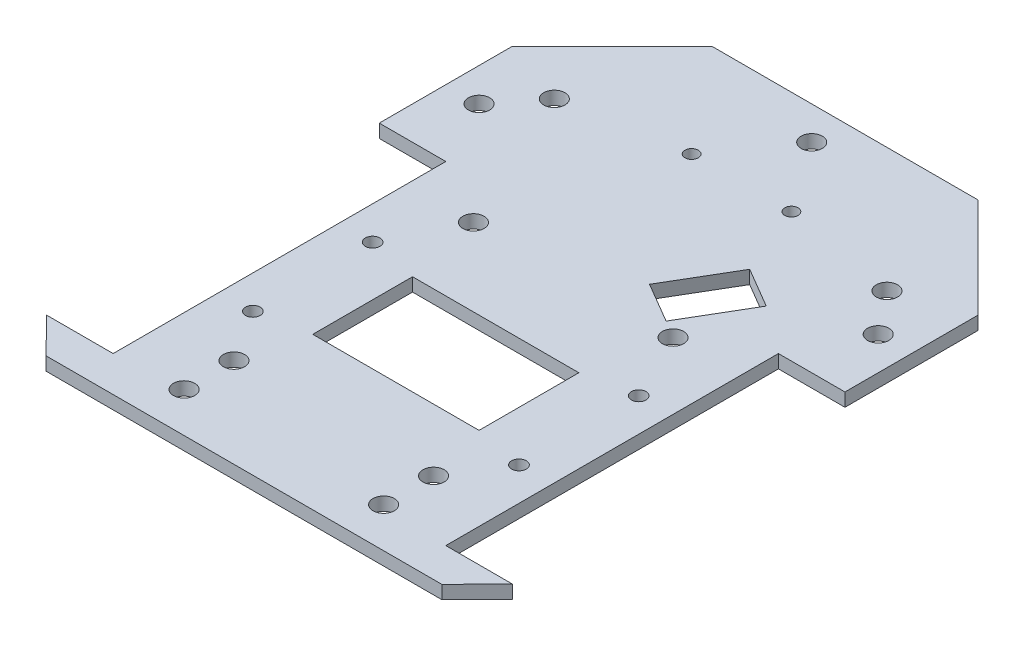
from build123d import *

# Parameters (mm, degrees)
SKETCH1_R           = 1.6
SKETCH1_R_2         = 1.1
SKETCH1_W           = 25
SKETCH1_H           = 15
BOSS_EXTRUDE1_DEPTH = 2
SKETCH2_R           = 1.6
CUT_EXTRUDE1_DEPTH  = 15
SKETCH3_R           = 1
CUT_EXTRUDE2_DEPTH  = 59.303758671


with BuildPart() as part:
    # Sketch1 → Boss-Extrude1 (new body)
    with BuildSketch(Plane(origin=(0, 0, 0), x_dir=(1, 0, 0), z_dir=(0, 1, 0))):
        Polygon((-20, 46.586782193), (20, 46.586782193), (35, 31.586782193), (35, 11.586782193), (25, 11.586782193), (25, -38.413217807), (35, -38.413217807), (29.754571716, -43.75543078), (-29.754571716, -43.75543078), (-35, -38.413217807), (-25, -38.413217807), (-25, 11.586782193), (-35, 11.586782193), (-35, 31.586782193), align=None)
        with Locations(Location((-30, 21.586782193, 0), (0, 0, 270))):
            Circle(SKETCH1_R, mode=Mode.SUBTRACT)
        with Locations(Location((30, 21.586782193, 0), (0, 0, 90))):
            Circle(SKETCH1_R, mode=Mode.SUBTRACT)
        with Locations(Location((0, 41.586782193, 0), (0, 0, 270))):
            Circle(SKETCH1_R, mode=Mode.SUBTRACT)
        with Locations(Location((-20, -4.413217807, 0), (0, 0, 270))):
            Circle(SKETCH1_R_2, mode=Mode.SUBTRACT)
        with Locations(Location((-20, -22.413217807, 0), (0, 0, 90))):
            Circle(SKETCH1_R_2, mode=Mode.SUBTRACT)
        with Locations(Location((20, -4.413217807, 0), (0, 0, 90))):
            Circle(SKETCH1_R_2, mode=Mode.SUBTRACT)
        with Locations(Location((20, -22.413217807, 0), (0, 0, 270))):
            Circle(SKETCH1_R_2, mode=Mode.SUBTRACT)
        with Locations(Location((-15, -37.75543078, 0), (0, 0, 270))):
            Circle(SKETCH1_R, mode=Mode.SUBTRACT)
        with Locations(Location((15, -37.75543078, 0), (0, 0, 90))):
            Circle(SKETCH1_R, mode=Mode.SUBTRACT)
        with Locations(Location((-15, 5.74456922, 0), (0, 0, 270))):
            Circle(SKETCH1_R, mode=Mode.SUBTRACT)
        with Locations(Location((15, 5.74456922, 0), (0, 0, 90))):
            Circle(SKETCH1_R, mode=Mode.SUBTRACT)
        with Locations(Location((-15, -30.25543078, 0), (0, 0, 270))):
            Circle(SKETCH1_R, mode=Mode.SUBTRACT)
        with Locations(Location((15, -30.25543078, 0), (0, 0, 90))):
            Circle(SKETCH1_R, mode=Mode.SUBTRACT)
        Polygon((12.330705785, 7.368716231), (17.905727496, 16.851286185), (11.871364798, 20.399027274), (6.296343087, 10.91645732), align=None, mode=Mode.SUBTRACT)
        with Locations((0, -13.413217807)):
            Rectangle(SKETCH1_W, SKETCH1_H, mode=Mode.SUBTRACT)
    extrude(amount=BOSS_EXTRUDE1_DEPTH)

    # Sketch2 → Cut-Extrude1 (cut)
    with BuildSketch(Plane(origin=(0, 2, 0), x_dir=(1, 0, 0), z_dir=(0, 1, 0))):
        with Locations(Location((-25, 27.900566449, 0), (0, 0, 270))):
            Circle(SKETCH2_R)
        with Locations(Location((25, 27.900566449, 0), (0, 0, 90))):
            Circle(SKETCH2_R)
    extrude(amount=-CUT_EXTRUDE1_DEPTH, mode=Mode.SUBTRACT)

    # Sketch3 → Cut-Extrude2 (cut, through all)
    with BuildSketch(Plane(origin=(0, 2, 0), x_dir=(1, 0, 0), z_dir=(0, 1, 0))):
        with Locations(Location((-7.5, 31.038288012, 0), (0, 0, 270))):
            Circle(SKETCH3_R)
        with Locations(Location((7.5, 31.038288012, 0), (0, 0, 90))):
            Circle(SKETCH3_R)
    extrude(amount=-CUT_EXTRUDE2_DEPTH, mode=Mode.SUBTRACT)


solid = part.part
